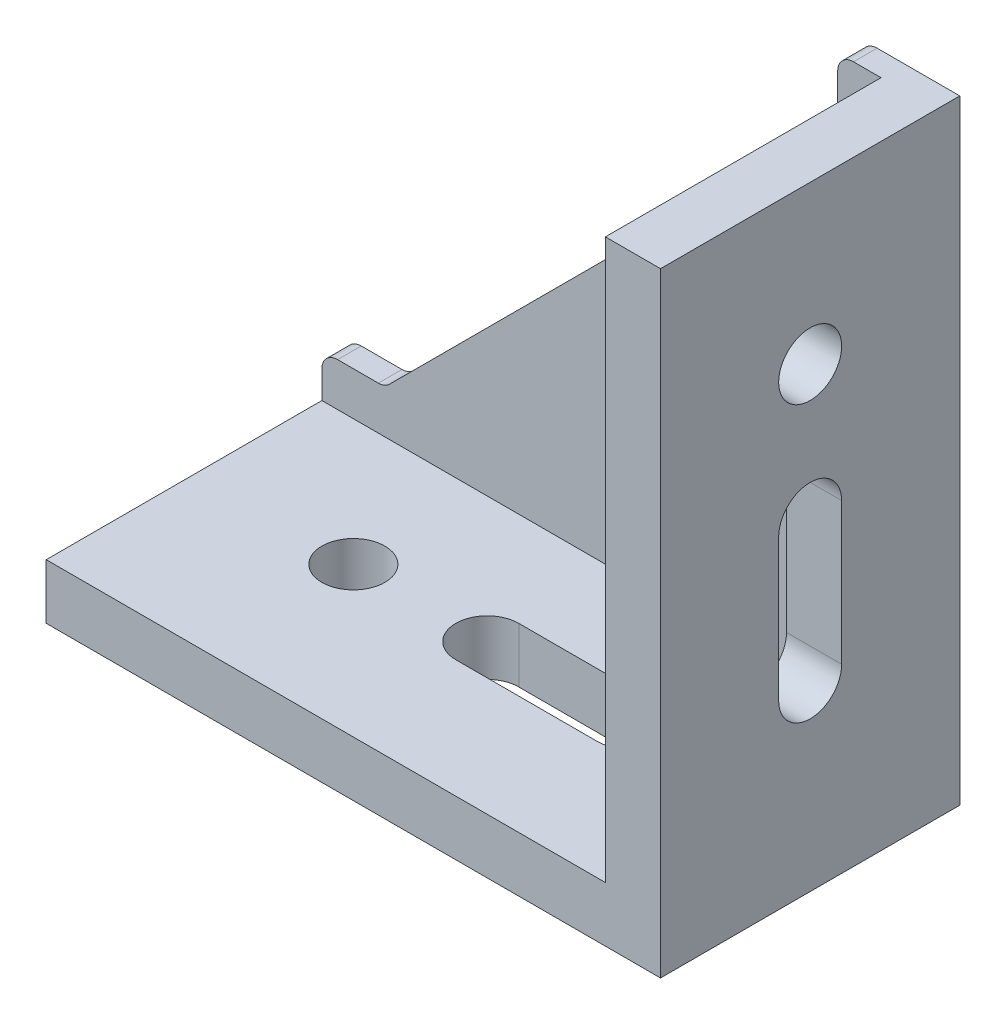
from build123d import *

# Parameters (mm, degrees)
EXTRUDE_1_DEPTH     = 35
EXTRUDE_2_DEPTH     = 3
SKETCH_3_R          = 4
CUT_EXTRUDE_1_DEPTH = 112.130553854
SKETCH_4_R          = 4
CUT_EXTRUDE_2_DEPTH = 112.130553854
FILLET_1_R          = 2
FILLET_2_R          = 2


with BuildPart() as part:
    # 草图1 → 凸台-拉伸1 (new body)
    with BuildSketch(Plane.XY):
        Polygon((0, 0), (78, 0), (78, 78), (71, 78), (71, 7), (0, 7), align=None)
    extrude(amount=EXTRUDE_1_DEPTH)

    # 草图2 → 凸台-拉伸2 (add)
    with BuildSketch(Plane(origin=(0, 0, 0), x_dir=(-1, 0, 0), z_dir=(0, 0, -1))):
        Polygon((-78, 78), (-78, 0), (0, 0), (0, 12.5), (-8, 12.5), (-65.5, 70), (-65.5, 78), align=None)
    extrude(amount=EXTRUDE_2_DEPTH)

    # 草图3 → 切除-拉伸1 (cut, through all)
    with BuildSketch(Plane.ZY.offset(-71)):
        with Locations((16, 58)):
            Circle(SKETCH_3_R)
        with BuildLine():
            Line((12, 41), (12, 23))
            ThreePointArc((12, 23), (16, 19), (20, 23))
            Line((20, 23), (20, 41))
            ThreePointArc((20, 41), (16, 45), (12, 41))
        make_face()
    extrude(amount=-CUT_EXTRUDE_1_DEPTH, mode=Mode.SUBTRACT)

    # 草图4 → 切除-拉伸2 (cut, through all)
    with BuildSketch(Plane(origin=(0, 7, 0), x_dir=(1, 0, 0), z_dir=(0, 1, 0))):
        with Locations(Location((20, -16, 0), (0, 0, 270))):
            Circle(SKETCH_4_R)
        with BuildLine():
            Line((37, -20), (55, -20))
            ThreePointArc((55, -20), (59, -16), (55, -12))
            Line((55, -12), (37, -12))
            ThreePointArc((37, -12), (33, -16), (37, -20))
        make_face()
    extrude(amount=-CUT_EXTRUDE_2_DEPTH, mode=Mode.SUBTRACT)

    # 圆角1
    fillet_1_edges = [part.edges().sort_by_distance(p)[0] for p in [
        (65.5, 78, -1.5),
        (0, 12.5, -1.5),
    ]]
    fillet(fillet_1_edges, radius=FILLET_1_R)

    # 圆角2
    fillet_2_edges = [part.edges().sort_by_distance(p)[0] for p in [
        (8, 12.5, -1.5),
        (65.5, 70, -1.5),
    ]]
    fillet(fillet_2_edges, radius=FILLET_2_R)


solid = part.part
